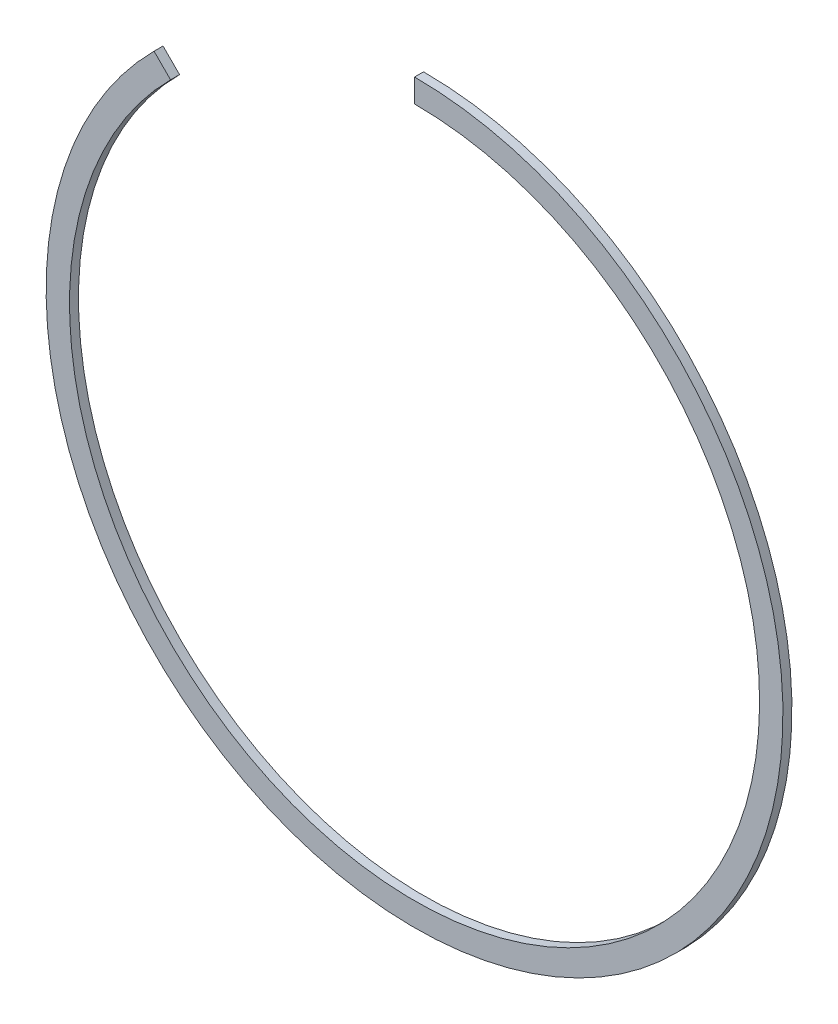
from build123d import *

# Parameters (mm, degrees)
BOSS_EXTRUDE1_DEPTH = 2.5


with BuildPart() as part:
    # Sketch1 → Boss-Extrude1 (new body)
    with BuildSketch(Plane.XY):
        with BuildLine():
            Line((0, 102.5), (0, 96))
            ThreePointArc((0, 96), (67.882250994, 67.882250994), (96, 0))
            ThreePointArc((96, 0), (-36.737609507, -88.692435121), (-67.882250994, 67.882250994))
            Line((-67.882250994, 67.882250994), (-72.478445072, 72.478445072))
            ThreePointArc((-72.478445072, 72.478445072), (-39.225051817, -94.697652082), (102.5, 0))
            ThreePointArc((102.5, 0), (72.478445072, 72.478445072), (0, 102.5))
        make_face()
    extrude(amount=BOSS_EXTRUDE1_DEPTH)


solid = part.part
